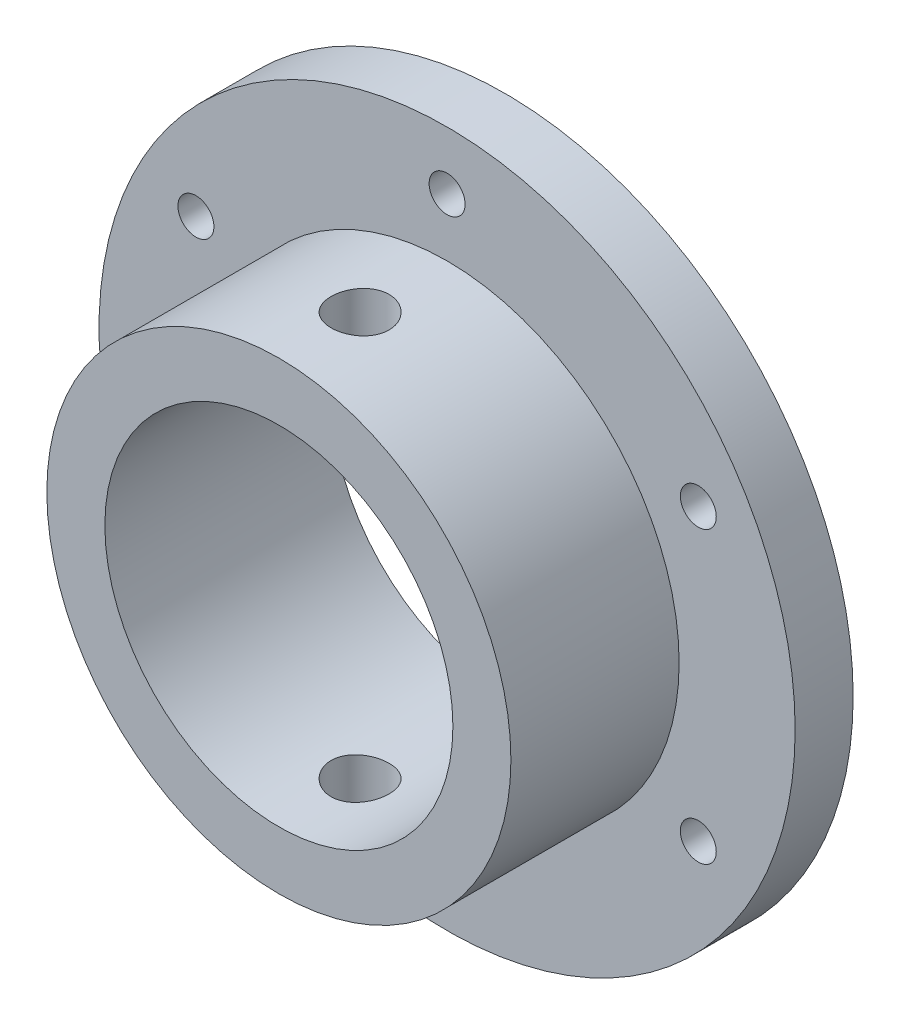
from build123d import *

# Parameters (mm, degrees)
SKETCH1_R               = 30
BOSS_EXTRUDE1_DEPTH     = 5
SKETCH2_R               = 20
SKETCH2_R_2             = 15
BOSS_EXTRUDE2_DEPTH     = 14.5
CUT_EXTRUDE1_START      = -20
SKETCH3_R               = 15
CUT_EXTRUDE1_DEPTH      = 20
CUT_EXTRUDE3_DEPTH      = 47.693147249
CUT_EXTRUDE3_DEPTH_BACK = 47.693147249
SKETCH5_R               = 2.5
SKETCH6_R               = 1.55
CUT_EXTRUDE4_DEPTH      = 10


with BuildPart() as part:
    # Sketch1 → Boss-Extrude1 (new body)
    with BuildSketch(Plane.XY):
        Circle(SKETCH1_R)
    extrude(amount=BOSS_EXTRUDE1_DEPTH)

    # Sketch2 → Boss-Extrude2 (add)
    with BuildSketch(Plane.XY.offset(5)):
        with Locations(Location((0, 0, 0), (0, 0, 180))):
            Circle(SKETCH2_R)
        with Locations(Location((0, 0, 0), (0, 0, 180))):
            Circle(SKETCH2_R_2, mode=Mode.SUBTRACT)
    extrude(amount=BOSS_EXTRUDE2_DEPTH)

    # Sketch3 → Cut-Extrude1 (cut)
    with BuildSketch(Plane.XY.offset(5).offset(CUT_EXTRUDE1_START)):
        with Locations(Location((0, 0, 0), (0, 0, 180))):
            Circle(SKETCH3_R)
    extrude(amount=CUT_EXTRUDE1_DEPTH, mode=Mode.SUBTRACT)

    # Sketch5 → Cut-Extrude3 (cut, two sides: drawn at the far end of the back side and taken through both)
    with BuildSketch(Plane(origin=(0, 0, 0), x_dir=(1, 0, 0), z_dir=(0, 1, 0)).offset(-CUT_EXTRUDE3_DEPTH_BACK)):
        with Locations(Location((0, -12.5, 0), (0, 0, 270))):
            Circle(SKETCH5_R)
    extrude(amount=CUT_EXTRUDE3_DEPTH + CUT_EXTRUDE3_DEPTH_BACK, mode=Mode.SUBTRACT)

    # Sketch6 → Cut-Extrude4 (cut)
    with BuildSketch(Plane.XY.offset(5)):
        with Locations((0, 25)):
            Circle(SKETCH6_R)
        with Locations((21.650635095, 12.5)):
            Circle(SKETCH6_R)
        with Locations((21.650635095, -12.5)):
            Circle(SKETCH6_R)
        with Locations((0, -25)):
            Circle(SKETCH6_R)
        with Locations((-21.650635095, -12.5)):
            Circle(SKETCH6_R)
        with Locations((-21.650635095, 12.5)):
            Circle(SKETCH6_R)
    extrude(amount=-CUT_EXTRUDE4_DEPTH, mode=Mode.SUBTRACT)


solid = part.part
